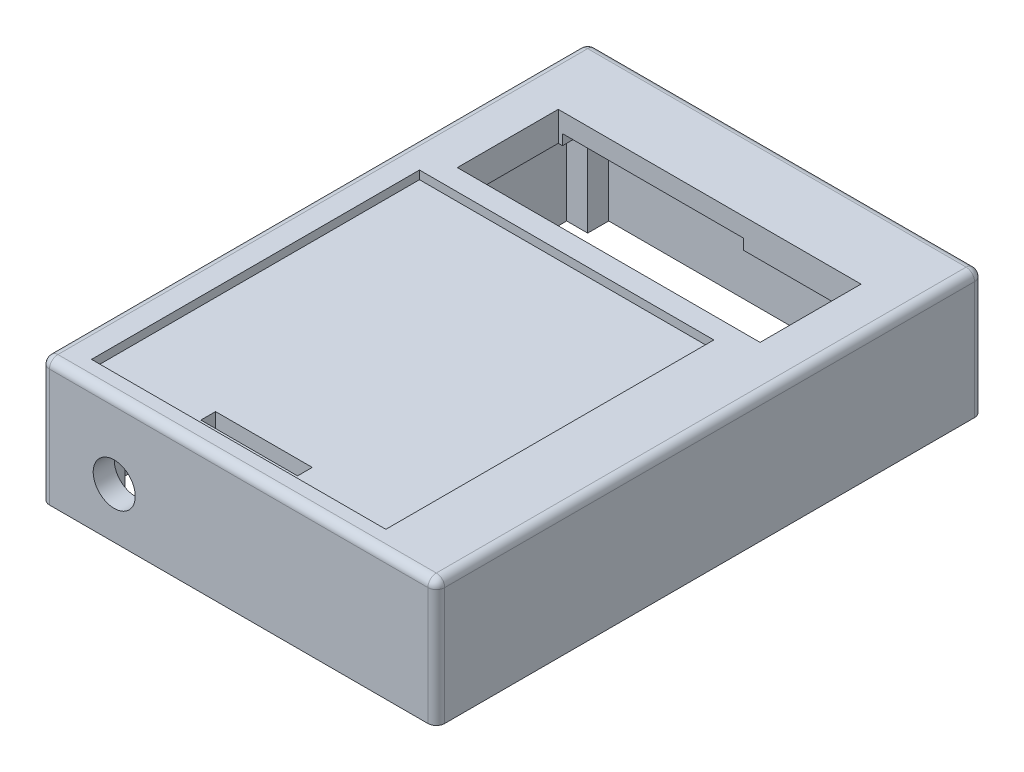
from build123d import *

# Parameters (mm, degrees)
SKETCH1_W           = 94
SKETCH1_H           = 130
BOSS_EXTRUDE1_DEPTH = 30
CUT_EXTRUDE2_DEPTH  = 23
SKETCH7_W           = 72
SKETCH7_H           = 24
CUT_EXTRUDE3_DEPTH  = 164.205392068
SKETCH8_W           = 6
SKETCH8_H           = 18
CUT_EXTRUDE4_DEPTH  = 4
SKETCH9_W           = 43
SKETCH9_H           = 8
CUT_EXTRUDE5_DEPTH  = 2.5
SKETCH10_W          = 70
SKETCH10_H          = 78
CUT_EXTRUDE6_DEPTH  = 2
SKETCH11_W          = 23
SKETCH11_H          = 3.5
CUT_EXTRUDE7_DEPTH  = 163.849623887
FILLET1_R           = 2
SKETCH12_R          = 5
CUT_EXTRUDE8_DEPTH  = 10


with BuildPart() as part:
    # Sketch1 → Boss-Extrude1 (new body)
    with BuildSketch(Plane(origin=(0, 0, 0), x_dir=(1, 0, 0), z_dir=(0, 1, 0))):
        with Locations((47, 65)):
            Rectangle(SKETCH1_W, SKETCH1_H)
    extrude(amount=BOSS_EXTRUDE1_DEPTH)

    # Sketch6 → Cut-Extrude2 (cut)
    with BuildSketch(Plane.XZ):
        Polygon((84, -125), (84, -120), (89, -120), (89, -10), (84, -10), (84, -5), (10, -5), (10, -10), (5, -10), (5, -120), (10, -120), (10, -125), align=None)
    extrude(amount=-CUT_EXTRUDE2_DEPTH, mode=Mode.SUBTRACT)

    # Sketch7 → Cut-Extrude3 (cut, through all)
    with BuildSketch(Plane(origin=(0, 30, 0), x_dir=(1, 0, 0), z_dir=(0, 1, 0))):
        with Locations((47, 100)):
            Rectangle(SKETCH7_W, SKETCH7_H)
    extrude(amount=-CUT_EXTRUDE3_DEPTH, mode=Mode.SUBTRACT)

    # Sketch8 → Cut-Extrude4 (cut)
    with BuildSketch(Plane.XZ.offset(-23)):
        with Locations((86, -100)):
            Rectangle(SKETCH8_W, SKETCH8_H)
    extrude(amount=-CUT_EXTRUDE4_DEPTH, mode=Mode.SUBTRACT)

    # Sketch9 → Cut-Extrude5 (cut)
    with BuildSketch(Plane.XZ.offset(-23)):
        with Locations((33.5, -116)):
            Rectangle(SKETCH9_W, SKETCH9_H)
    extrude(amount=-CUT_EXTRUDE5_DEPTH, mode=Mode.SUBTRACT)

    # Sketch10 → Cut-Extrude6 (cut)
    with BuildSketch(Plane(origin=(0, 30, 0), x_dir=(1, 0, 0), z_dir=(0, 1, 0))):
        with Locations((42, 44)):
            Rectangle(SKETCH10_W, SKETCH10_H)
    extrude(amount=-CUT_EXTRUDE6_DEPTH, mode=Mode.SUBTRACT)

    # Sketch11 → Cut-Extrude7 (cut, through all)
    with BuildSketch(Plane(origin=(0, 28, 0), x_dir=(1, 0, 0), z_dir=(0, 1, 0))):
        with Locations((42, 9.25)):
            Rectangle(SKETCH11_W, SKETCH11_H)
    extrude(amount=-CUT_EXTRUDE7_DEPTH, mode=Mode.SUBTRACT)

    # Fillet1
    fillet1_edges = [part.edges().sort_by_distance(p)[0] for p in [
        (0, 15, 0),
        (47, 30, 0),
        (94, 15, 0),
        (94, 30, -65),
        (94, 15, -130),
        (0, 15, -130),
        (0, 30, -65),
        (47, 30, -130),
    ]]
    fillet(fillet1_edges, radius=FILLET1_R)

    # Sketch12 → Cut-Extrude8 (cut)
    with BuildSketch(Plane.XY):
        with Locations((17.400096769, 12)):
            Circle(SKETCH12_R)
    extrude(amount=-CUT_EXTRUDE8_DEPTH, mode=Mode.SUBTRACT)


solid = part.part
